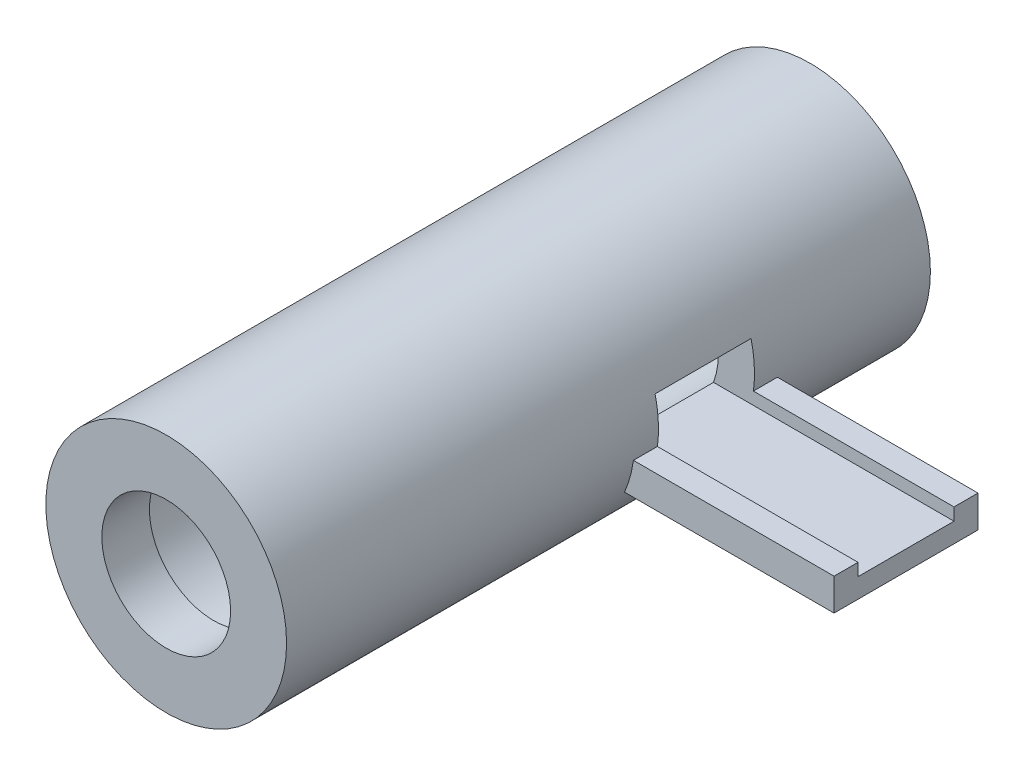
from build123d import *

# Parameters (mm, degrees)
SKETCH2_W           = 12
SKETCH2_H           = 7.1
CUT_EXTRUDE2_DEPTH  = 30
BOSS_EXTRUDE1_DEPTH = 40
SKETCH5_R           = 10.55
CUT_EXTRUDE3_DEPTH  = 86.931397056


with BuildPart() as part:
    # Sketch1 → Revolve2 (revolve)
    with BuildSketch(Plane(origin=(0, 0, 0), x_dir=(1, 0, 0), z_dir=(0, 1, 0))):
        Polygon((8.05, 0), (15.05, 0), (15.05, 80.5), (10.55, 80.5), (10.55, 5.95), (8.05, 5.95), align=None)
    revolve(axis=Axis((0, 0, 0), (0, 0, -1)))

    # Sketch2 → Cut-Extrude2 (cut)
    with BuildSketch(Plane(origin=(0, 0, 0), x_dir=(0, 0, -1), z_dir=(1, 0, 0))):
        with Locations((52.5, 0)):
            Rectangle(SKETCH2_W, SKETCH2_H)
    extrude(amount=CUT_EXTRUDE2_DEPTH, mode=Mode.SUBTRACT)

    # Sketch3 → Boss-Extrude1 (add)
    with BuildSketch(Plane(origin=(0, 0, 0), x_dir=(0, 0, -1), z_dir=(1, 0, 0))):
        Polygon((46.5, -2), (43.5, -2), (43.5, -6), (52.5, -6), (61.5, -6), (61.5, -2), (58.5, -2), (58.5, -3.55), (46.5, -3.55), align=None)
    extrude(amount=BOSS_EXTRUDE1_DEPTH)

    # Sketch5 → Cut-Extrude3 (cut, through all)
    with BuildSketch(Plane.XY.offset(-5.95)):
        Circle(SKETCH5_R)
    extrude(amount=-CUT_EXTRUDE3_DEPTH, mode=Mode.SUBTRACT)


solid = part.part
